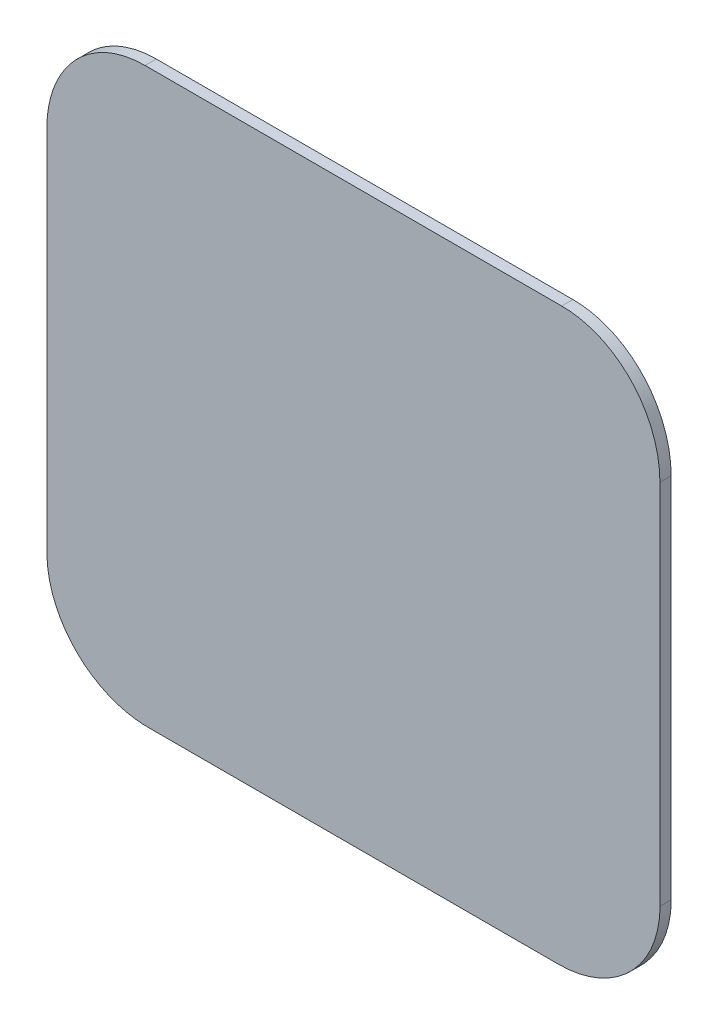
from build123d import *

# Parameters (mm, degrees)
SKETCH1_W               = 208.77467438
SKETCH1_H               = 197.406670985
BOSS_EXTRUDE1_DEPTH     = 3
CUT_EXTRUDE1_DEPTH      = 164.40940796
CUT_EXTRUDE1_DEPTH_BACK = 164.40940796
SKETCH3_OUTSIDE_W       = 268.242
SKETCH3_OUTSIDE_H       = 256.875


with BuildPart() as part:
    # Sketch1 → Boss-Extrude1 (new body)
    with BuildSketch(Plane.XY):
        with Locations((-0.931028509, 26.203335493)):
            Rectangle(SKETCH1_W, SKETCH1_H)
    extrude(amount=BOSS_EXTRUDE1_DEPTH)

    # Sketch3 outside → Cut-Extrude1 (cut, two sides: drawn at the far end of the back side and taken through both)
    with BuildSketch(Plane.XY.offset(3).offset(-CUT_EXTRUDE1_DEPTH_BACK)):
        with Locations((-0.931, 26.2035)):
            Rectangle(SKETCH3_OUTSIDE_W, SKETCH3_OUTSIDE_H)
        with BuildLine():
            Line((-81.985928335, -42.5), (-81.985928335, 55.696425663))
            add(Edge.make_bspline(
                [(-81.985928335, 55.696425663), (-81.985928335, 57.480534677), (-81.828701176, 59.238428606), (-81.362703019, 61.836894473), (-81.168655213, 62.696594648), (-80.817659424, 63.976153538), (-80.690657051, 64.401005201), (-80.416120483, 65.247285176), (-80.268341823, 65.669201948), (-79.485311166, 67.74790183), (-78.713759279, 69.329933851), (-77.337651642, 71.580982924), (-76.842253677, 72.310870019), (-75.774816372, 73.727906406), (-75.200545054, 74.416732357), (-73.399650263, 76.369557228), (-72.084874818, 77.537197895), (-69.938884948, 79.084287147), (-69.193659576, 79.566114694), (-67.644825986, 80.455903449), (-66.854202021, 80.856496815), (-64.435175535, 81.929383584), (-62.76006993, 82.474017815), (-60.586090646, 82.935871053), (-60.146240413, 83.017331265), (-59.264963373, 83.156629561), (-58.823290579, 83.214583953), (-57.495197363, 83.353679385), (-56.605709599, 83.400137351), (-55.712113128, 83.400137351)],
                knots=[0, 0, 0, 0, 0.125, 0.125, 0.1875, 0.1875, 0.21875, 0.21875, 0.25, 0.25, 0.375, 0.375, 0.4375, 0.4375, 0.5, 0.5, 0.625, 0.625, 0.6875, 0.6875, 0.75, 0.75, 0.875, 0.875, 0.90625, 0.90625, 0.9375, 0.9375, 1, 1, 1, 1], degree=3))
            Line((-55.712113128, 83.400137351), (55.712113128, 83.400137351))
            add(Edge.make_bspline(
                [(55.712113128, 83.400137351), (57.497242838, 83.400137351), (59.251060991, 83.216089045), (61.836179278, 82.671928723), (62.690228593, 82.445535646), (63.959478786, 82.036446245), (64.38147595, 81.888081723), (65.212077414, 81.571329483), (65.621681438, 81.402672573), (67.641787253, 80.509011364), (69.169338506, 79.634307087), (71.328904651, 78.084463437), (72.029153614, 77.525182809), (73.355882665, 76.35032325), (74.61576323, 75.115096033), (75.746300865, 73.76306543), (76.545945736, 72.705462674), (76.804437526, 72.345652984), (77.30518303, 71.611369777), (77.547868028, 71.236112589), (78.709005613, 69.341527304), (79.480407253, 67.756774461), (80.414952122, 65.282029433), (80.68910641, 64.440727699), (81.161932034, 62.725016727), (81.358808241, 61.856167244), (81.828919146, 59.242044526), (81.985928335, 57.47928148), (81.985928335, 55.696425663)],
                knots=[0, 0, 0, 0, 0.125, 0.125, 0.1875, 0.1875, 0.21875, 0.21875, 0.25, 0.25, 0.375, 0.375, 0.4375, 0.4375, 0.5, 0.5625, 0.5625, 0.59375, 0.59375, 0.625, 0.625, 0.75, 0.75, 0.8125, 0.8125, 0.875, 0.875, 1, 1, 1, 1], degree=3))
            Line((81.985928335, 55.696425663), (81.985928335, -42.5))
            add(Edge.make_bspline(
                [(81.985928335, -42.5), (81.986203644, -44.287285237), (81.809901717, -46.044499409), (81.291534566, -48.637079121), (81.076109979, -49.494011536), (80.558046439, -51.193023778), (80.25407127, -52.037011955), (79.230272052, -54.491245533), (78.395084715, -56.042839053), (77.162096296, -57.877633011), (76.905963129, -58.23930967), (76.374323181, -58.951931073), (76.098001775, -59.303830549), (75.246547421, -60.334465254), (74.64927886, -60.988355507), (72.771357993, -62.853544286), (71.405402717, -63.969270823), (69.552101326, -65.200512974), (69.173205674, -65.438989032), (68.408349501, -65.894477816), (68.021689437, -66.1120138), (66.849244821, -66.734554973), (65.252805428, -67.484573056), (63.590991588, -68.076894408), (62.319780084, -68.461189354), (61.891893773, -68.579279078), (61.02767473, -68.795084), (60.590982473, -68.892814069), (58.406172049, -69.325774201), (56.638810883, -69.499728058), (54.851793425, -69.5)],
                knots=[0, 0, 0, 0, 0.125, 0.125, 0.1875, 0.1875, 0.25, 0.25, 0.375, 0.375, 0.40625, 0.40625, 0.4375, 0.4375, 0.5, 0.5, 0.625, 0.625, 0.65625, 0.65625, 0.6875, 0.6875, 0.75, 0.8125, 0.8125, 0.84375, 0.84375, 0.875, 0.875, 1, 1, 1, 1], degree=3))
            Line((54.851793425, -69.5), (-54.843453461, -69.5))
            add(Edge.make_bspline(
                [(-81.985928335, -42.5), (-81.985928335, -44.287558655), (-81.809328529, -46.04501477), (-81.290482101, -48.637912138), (-81.074892306, -49.494942838), (-80.5564872, -51.194136105), (-80.252335175, -52.03820711), (-79.228000127, -54.492660255), (-78.39244508, -56.044363985), (-77.158984035, -57.879250925), (-76.902755688, -58.240943921), (-76.370924048, -58.953593408), (-76.094505857, -59.305504654), (-75.242761547, -60.336167409), (-74.645300231, -60.990066774), (-72.766802697, -62.855255026), (-71.40046509, -63.970944322), (-69.54668849, -65.202092726), (-69.167697725, -65.440547593), (-68.402653545, -65.895989636), (-68.015900398, -66.113500043), (-66.843179244, -66.735957991), (-65.246378354, -67.485847817), (-63.584217239, -68.07800684), (-62.312750686, -68.462167088), (-61.884780262, -68.580209751), (-61.020394829, -68.795916147), (-60.583620238, -68.8935947), (-58.398406517, -69.326288528), (-56.630746271, -69.5), (-54.843453461, -69.5)],
                knots=[0, 0, 0, 0, 0.125, 0.125, 0.1875, 0.1875, 0.25, 0.25, 0.375, 0.375, 0.40625, 0.40625, 0.4375, 0.4375, 0.5, 0.5, 0.625, 0.625, 0.65625, 0.65625, 0.6875, 0.6875, 0.75, 0.8125, 0.8125, 0.84375, 0.84375, 0.875, 0.875, 1, 1, 1, 1], degree=3))
        make_face(mode=Mode.SUBTRACT)
    extrude(amount=CUT_EXTRUDE1_DEPTH + CUT_EXTRUDE1_DEPTH_BACK, mode=Mode.SUBTRACT)


solid = part.part
